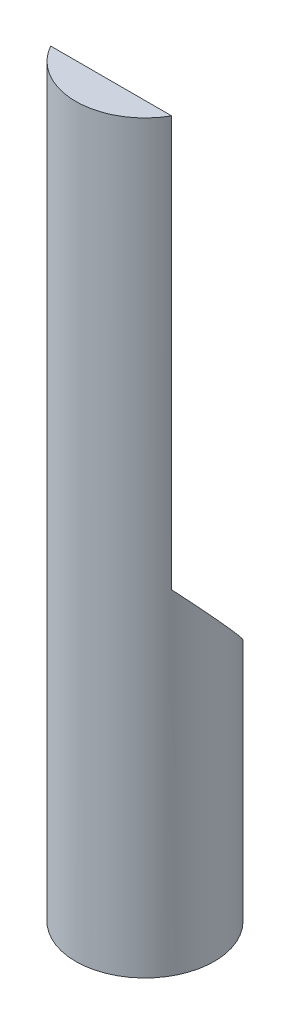
from build123d import *

# Parameters (mm, degrees)
SKETCH1_R               = 3.97129
BOSS_EXTRUDE1_DEPTH     = 42.672
CUT_EXTRUDE1_DEPTH      = 44.040003166
CUT_EXTRUDE1_DEPTH_BACK = 44.040003166


with BuildPart() as part:
    # Sketch1 → Boss-Extrude1 (new body)
    with BuildSketch(Plane(origin=(0, 0, 0), x_dir=(1, 0, 0), z_dir=(0, 1, 0))):
        with Locations(Location((0, 0, 0), (0, 0, 270))):
            Circle(SKETCH1_R)
    extrude(amount=BOSS_EXTRUDE1_DEPTH)

    # Sketch2 → Cut-Extrude1 (cut, two sides: drawn at the far end of the back side and taken through both)
    with BuildSketch(Plane(origin=(0, 0, 0), x_dir=(0, 0, -1), z_dir=(1, 0, 0)).offset(-CUT_EXTRUDE1_DEPTH_BACK)):
        Polygon((-1.93929, 47.484126656), (-1.93929, 19.160593828), (3.97129, 12.7), (3.97129, 47.484126656), align=None)
    extrude(amount=CUT_EXTRUDE1_DEPTH + CUT_EXTRUDE1_DEPTH_BACK, mode=Mode.SUBTRACT)


solid = part.part
